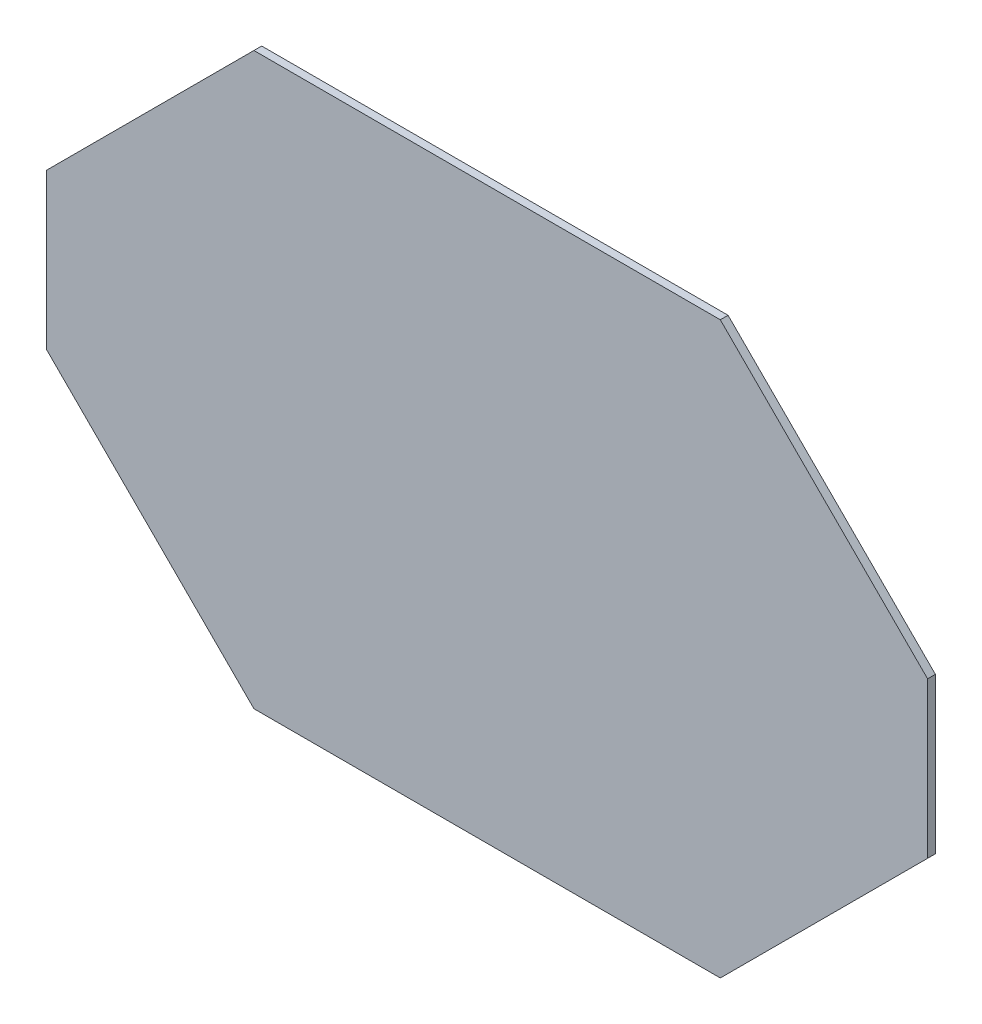
from build123d import *

# Parameters (mm, degrees)
SKETCH1_W           = 863.6
SKETCH1_H           = 558.8
BOSS_EXTRUDE1_DEPTH = 7.62
CHAMFER1_SIZE       = 203.2
CHAMFER2_SIZE       = 203.2
CHAMFER3_SIZE       = 203.2
CHAMFER4_SIZE       = 203.2


with BuildPart() as part:
    # Sketch1 → Boss-Extrude1 (new body)
    with BuildSketch(Plane.XY):
        with Locations((7.119883608, -41.512124151)):
            Rectangle(SKETCH1_W, SKETCH1_H)
    extrude(amount=BOSS_EXTRUDE1_DEPTH)

    # Chamfer1
    chamfer1_edges = [part.edges().sort_by_distance(p)[0] for p in [
        (-424.680116392, 237.887875849, 3.81),
    ]]
    chamfer(chamfer1_edges, length=CHAMFER1_SIZE)

    # Chamfer2
    chamfer2_edges = [part.edges().sort_by_distance(p)[0] for p in [
        (-424.680116392, -320.912124151, 3.81),
    ]]
    chamfer(chamfer2_edges, length=CHAMFER2_SIZE)

    # Chamfer3
    chamfer3_edges = [part.edges().sort_by_distance(p)[0] for p in [
        (438.919883608, -320.912124151, 3.81),
    ]]
    chamfer(chamfer3_edges, length=CHAMFER3_SIZE)

    # Chamfer4
    chamfer4_edges = [part.edges().sort_by_distance(p)[0] for p in [
        (438.919883608, 237.887875849, 3.81),
    ]]
    chamfer(chamfer4_edges, length=CHAMFER4_SIZE)


solid = part.part
